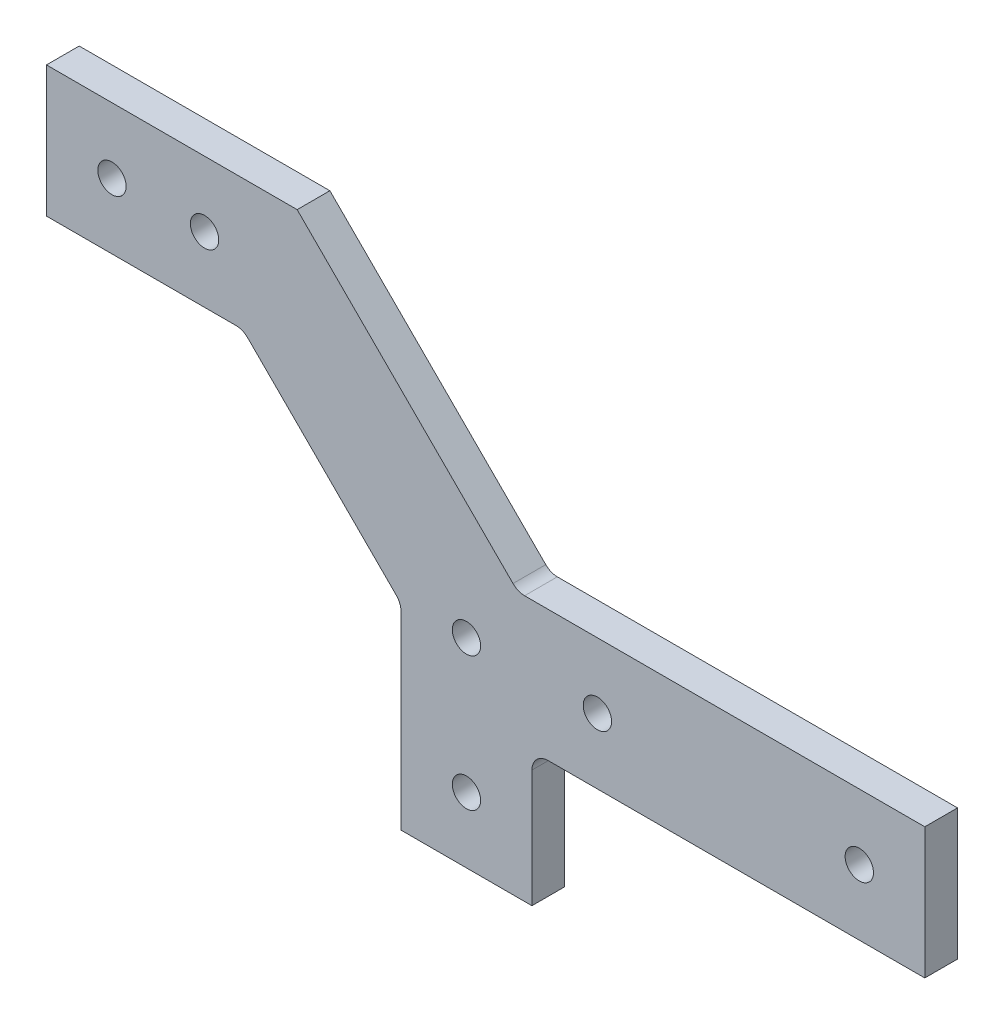
from build123d import *

# Parameters (mm, degrees)
BOSS_EXTRUDE1_DEPTH      = 6.35
FILLET1_R                = 3.175
M5_CLEARANCE_HOLE1_D     = 5.5
M5_CLEARANCE_HOLE1_DEPTH = 18.75
M5_CLEARANCE_HOLE1_TIP   = 1.652366702


with BuildPart() as part:
    # Sketch1 → Boss-Extrude1 (new body)
    with BuildSketch(Plane.XY):
        Polygon((-12.7, 46.1), (-12.7, 58.239487758), (-43.360512242, 88.9), (-81.460512242, 88.9), (-81.460512242, 114.3), (-32.839487758, 114.3), (9.960512242, 71.5), (12.7, 71.5), (88.9, 71.5), (88.9, 46.1), (12.7, 46.1), (12.7, 20.139487758), (-12.7, 20.139487758), align=None)
    extrude(amount=BOSS_EXTRUDE1_DEPTH)

    # Fillet1
    fillet1_edges = [part.edges().sort_by_distance(p)[0] for p in [
        (-12.7, 58.239487758, 3.175),
        (-43.360512242, 88.9, 3.175),
        (9.960512242, 71.5, 3.175),
        (12.7, 46.1, 3.175),
    ]]
    fillet(fillet1_edges, radius=FILLET1_R)

    # M5 Clearance Hole1
    with Locations(Plane.XY.offset(6.35)):
        with Locations((0, 58.8), (25.4, 58.8), (76.2, 58.8), (-50.8, 101.6), (-68.760512242, 101.6), (0, 32.839487758)):
            Hole(M5_CLEARANCE_HOLE1_D / 2, depth=M5_CLEARANCE_HOLE1_DEPTH)
            with Locations((0, 0, -(M5_CLEARANCE_HOLE1_DEPTH + M5_CLEARANCE_HOLE1_TIP / 2))):  # 118° drill point
                Cone(0, M5_CLEARANCE_HOLE1_D / 2, M5_CLEARANCE_HOLE1_TIP, mode=Mode.SUBTRACT)


solid = part.part
